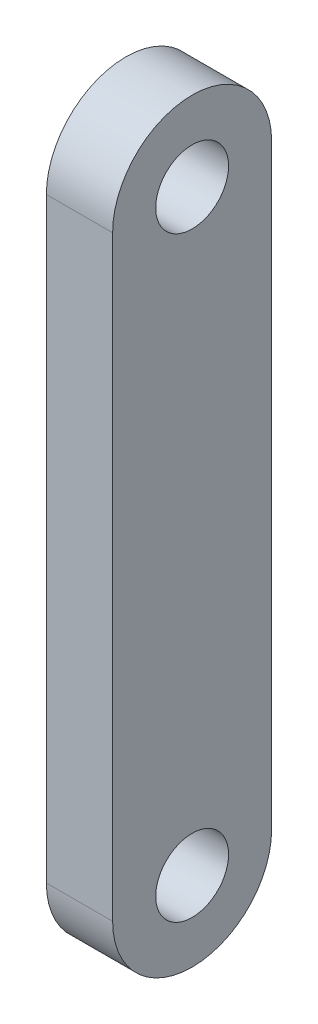
from build123d import *

# Parameters (mm, degrees)
SKETCH1_R           = 2.75
BOSS_EXTRUDE1_DEPTH = 5


with BuildPart() as part:
    # Sketch1 → Boss-Extrude1 (new body)
    with BuildSketch(Plane.YZ):
        with BuildLine():
            Line((0, 6), (45, 6))
            ThreePointArc((45, 6), (51, 0), (45, -6))
            Line((45, -6), (0, -6))
            ThreePointArc((0, -6), (-6, 0), (0, 6))
        make_face()
        with Locations(Location((0, 0, 0), (0, 0, 270))):
            Circle(SKETCH1_R, mode=Mode.SUBTRACT)
        with Locations(Location((45, 0, 0), (0, 0, 270))):
            Circle(SKETCH1_R, mode=Mode.SUBTRACT)
    extrude(amount=BOSS_EXTRUDE1_DEPTH)


solid = part.part
